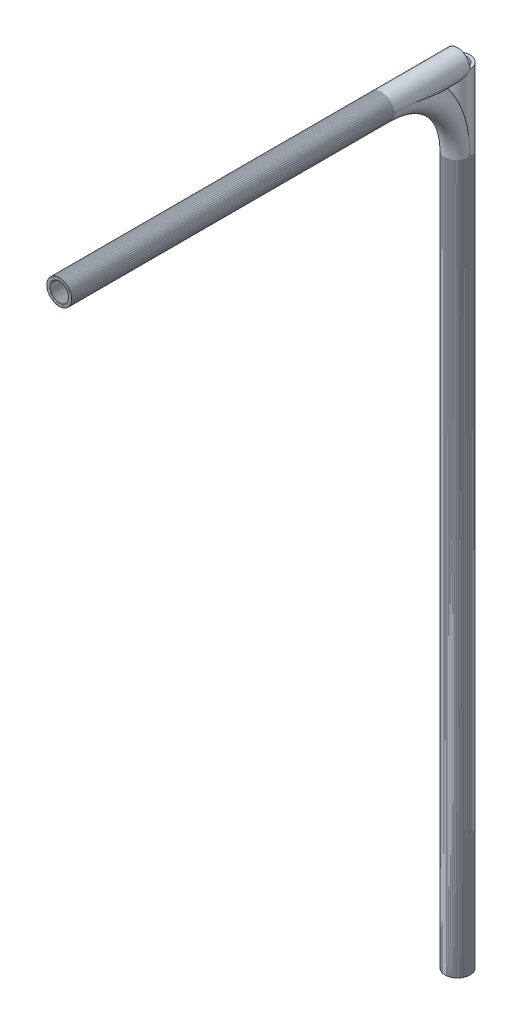
from build123d import *

# Parameters (mm, degrees)
SWEEP_THIN1_PROFILE_R   = 4.065
SWEEP_THIN1_PROFILE_R_2 = 3.065
SWEEP_THIN2_PROFILE_R   = 4.065
SWEEP_THIN2_PROFILE_R_2 = 3.065
SWEEP_THIN3_PROFILE_R   = 4.065
SWEEP_THIN3_PROFILE_R_2 = 3.065


with BuildPart() as part:
    # Sweep-Thin1: sweep along a path in Sketch1
    with BuildLine(Plane(origin=(0, 0, 0), x_dir=(0, 0, -1), z_dir=(1, 0, 0))) as sweep_thin1_path:
        Line((20, 0), (125, 0))
        ThreePointArc((125, 0), (142.67766953, -7.32233047), (150, -25))
        Line((150, -25), (150, -256))
    # Sweep-Thin1 profile (on start of the path) → Sweep-Thin1 (sweep)
    with BuildSketch(Plane(origin=(0, 0, -20), x_dir=(-1, 0, 0), z_dir=(0, 0, -1))):
        Circle(SWEEP_THIN1_PROFILE_R)
        Circle(SWEEP_THIN1_PROFILE_R_2, mode=Mode.SUBTRACT)
    sweep(path=sweep_thin1_path.line)


with BuildPart() as body_2:
    # Sweep-Thin2: sweep along a path in Sketch12
    with BuildLine(Plane(origin=(0, 0, 0), x_dir=(0, 0, -1), z_dir=(1, 0, 0))) as sweep_thin2_path:
        Line((20, 0), (150, 0))
    # Sweep-Thin2 profile (on start of the path) → Sweep-Thin2 (sweep)
    with BuildSketch(Plane(origin=(0, 0, -20), x_dir=(-1, 0, 0), z_dir=(0, 0, -1))):
        Circle(SWEEP_THIN2_PROFILE_R)
        Circle(SWEEP_THIN2_PROFILE_R_2, mode=Mode.SUBTRACT)
    sweep(path=sweep_thin2_path.line)


with BuildPart() as body_3:
    # Sweep-Thin3: sweep along a path in Sketch23
    with BuildLine(Plane(origin=(0, 0, 0), x_dir=(0, 0, -1), z_dir=(1, 0, 0))) as sweep_thin3_path:
        Line((150, -256), (150, 0))
    # Sweep-Thin3 profile (on start of the path) → Sweep-Thin3 (sweep)
    with BuildSketch(Plane(origin=(0, -256, -150), x_dir=(0, 0, 1), z_dir=(0, 1, 0))):
        Circle(SWEEP_THIN3_PROFILE_R)
        Circle(SWEEP_THIN3_PROFILE_R_2, mode=Mode.SUBTRACT)
    sweep(path=sweep_thin3_path.line)


solid = Compound([part.part, body_2.part, body_3.part])
